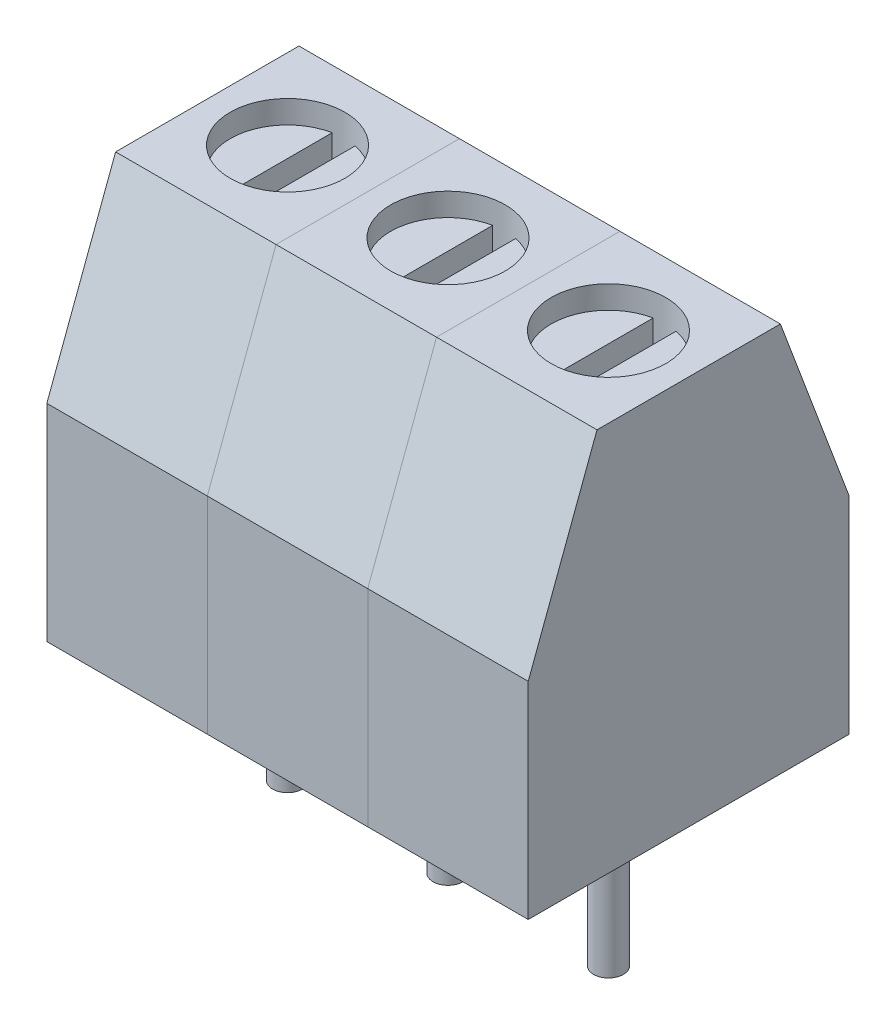
from build123d import *

# Parameters (mm, degrees)
EXTRUDE_1_DEPTH     = 3.5
SKETCH_3_W          = 3
SKETCH_3_H          = 4
CUT_EXTRUDE_1_DEPTH = 1.5
SKETCH_4_R          = 1.25
CUT_EXTRUDE_2_DEPTH = 0.5
CUT_EXTRUDE_3_DEPTH = 0.5
SKETCH_7_R          = 1
CUT_EXTRUDE_4_DEPTH = 3
SKETCH1_R           = 0.325
BOSS_EXTRUDE1_DEPTH = 3.5
LPATTERN1_COUNT     = 3
LPATTERN1_PITCH     = 3.5


with BuildPart() as part:
    # 스케치1 → 보스-돌출1 (new body)
    with BuildSketch(Plane(origin=(0, 0, 0), x_dir=(0, 0, -1), z_dir=(1, 0, 0))):
        Polygon((0, 0), (7, 0), (7, 4.5), (5.5, 8.5), (1.5, 8.5), (0, 4.5), align=None)
    extrude(amount=EXTRUDE_1_DEPTH)

    # 스케치3 → 컷-돌출1 (cut)
    with BuildSketch(Plane(origin=(0, 0, -7), x_dir=(-1, 0, 0), z_dir=(0, 0, -1))):
        with Locations((-1.75, 2.5)):
            Rectangle(SKETCH_3_W, SKETCH_3_H)
    extrude(amount=-CUT_EXTRUDE_1_DEPTH, mode=Mode.SUBTRACT)

    # 스케치4 → 컷-돌출2 (cut)
    with BuildSketch(Plane(origin=(0, 8.5, 0), x_dir=(1, 0, 0), z_dir=(0, 1, 0))):
        with Locations(Location((1.75, 3.5, 0), (0, 0, 270))):
            Circle(SKETCH_4_R)
    extrude(amount=-CUT_EXTRUDE_2_DEPTH, mode=Mode.SUBTRACT)

    # 스케치5 → 컷-돌출3 (cut)
    with BuildSketch(Plane(origin=(0, 8, 0), x_dir=(1, 0, 0), z_dir=(0, 1, 0))):
        with BuildLine():
            Line((1.500050042, 4.724755085), (1.500050042, 2.275244915))
            ThreePointArc((1.500050042, 2.275244915), (1.75, 2.25), (1.999949958, 2.275244915))
            Line((1.999949958, 2.275244915), (1.999949958, 4.724755085))
            ThreePointArc((1.999949958, 4.724755085), (1.75, 4.75), (1.500050042, 4.724755085))
        make_face()
    extrude(amount=-CUT_EXTRUDE_3_DEPTH, mode=Mode.SUBTRACT)

    # 스케치7 → 컷-돌출4 (cut)
    with BuildSketch(Plane(origin=(0, 0, -5.5), x_dir=(-1, 0, 0), z_dir=(0, 0, -1))):
        with Locations((-1.75, 2)):
            Circle(SKETCH_7_R)
    extrude(amount=-CUT_EXTRUDE_4_DEPTH, mode=Mode.SUBTRACT)

    # Sketch1 → Boss-Extrude1 (add)
    with BuildSketch(Plane.XZ):
        with Locations(Location((1.75, -3.5, 0), (0, 0, 90))):
            Circle(SKETCH1_R)
    extrude(amount=BOSS_EXTRUDE1_DEPTH)


with BuildPart() as lpattern1_1:
    # LPattern1: pattern copy
    add(part.part.moved(Location(Vector(1, 0, 0) * (1 * LPATTERN1_PITCH))))


with BuildPart() as lpattern1_2:
    # LPattern1: pattern copy
    add(part.part.moved(Location(Vector(1, 0, 0) * (2 * LPATTERN1_PITCH))))


solid = Compound([part.part, lpattern1_1.part, lpattern1_2.part])
